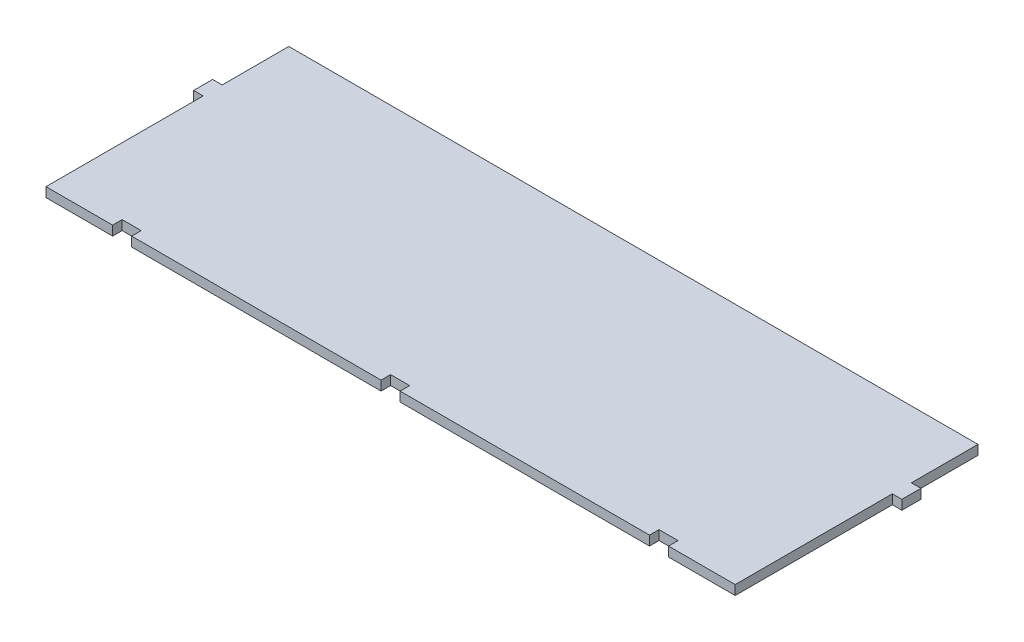
from build123d import *

# Parameters (mm, degrees)
BOSS_EXTRUDE1_DEPTH = 5


with BuildPart() as part:
    # Sketch1 → Boss-Extrude1 (new body)
    with BuildSketch(Plane(origin=(0, 0, 0), x_dir=(1, 0, 0), z_dir=(0, 1, 0))):
        Polygon((-186, 33.695), (-181, 33.695), (-181, 68.695), (181, 68.695), (181, 33.695), (186, 33.695), (186, 23.695), (181, 23.695), (181, -58.845), (146, -58.845), (146, -53.845), (136, -53.845), (136, -58.845), (5, -58.845), (5, -53.845), (-5, -53.845), (-5, -58.845), (-136, -58.845), (-136, -53.845), (-146, -53.845), (-146, -58.845), (-181, -58.845), (-181, 23.695), (-186, 23.695), align=None)
    extrude(amount=BOSS_EXTRUDE1_DEPTH)


solid = part.part
